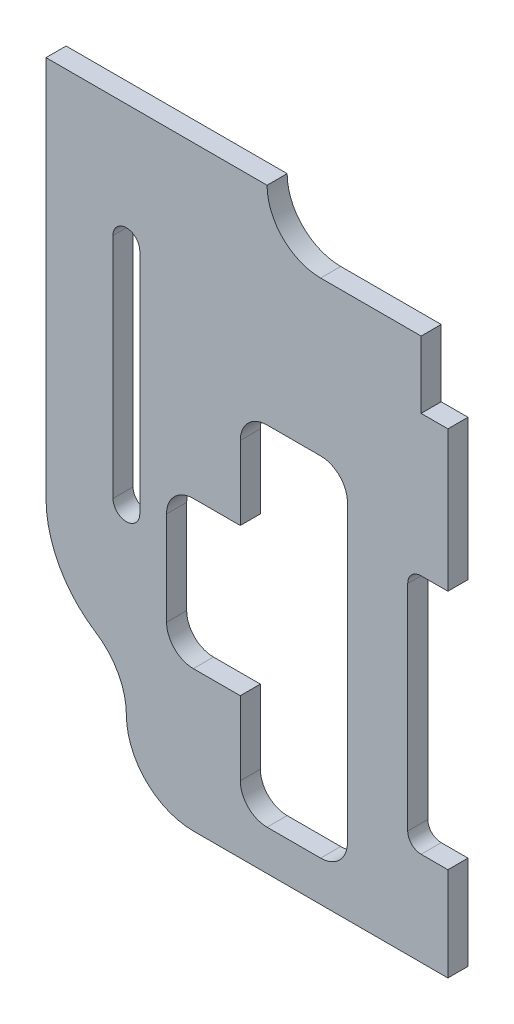
from build123d import *

# Parameters (mm, degrees)
BOSS_EXTRUDE1_DEPTH = 1.5


with BuildPart() as part:
    # Sketch1 → Boss-Extrude1 (new body)
    with BuildSketch(Plane.XY):
        with BuildLine():
            Line((-19, 0), (0, 0))
            Line((0, 0), (0, 7))
            Line((0, 7), (-2, 7))
            ThreePointArc((-2, 7), (-2.707106781, 7.292893219), (-3, 8))
            Line((-3, 8), (-3, 24))
            ThreePointArc((-3, 24), (-2.707106781, 24.707106781), (-2, 25))
            Line((-2, 25), (0, 25))
            Line((0, 25), (0, 35.5))
            Line((0, 35.5), (-2, 35.5))
            Line((-2, 35.5), (-2, 40.5))
            Line((-2, 40.5), (-9.5, 40.5))
            ThreePointArc((-9.5, 40.5), (-12.328427125, 41.671572875), (-13.5, 44.5))
            Line((-13.5, 44.5), (-30, 44.5))
            Line((-30, 44.5), (-30, 16))
            ThreePointArc((-30, 16), (-29.012989214, 12.12927861), (-26.292993631, 9.203821656))
            ThreePointArc((-26.292993631, 9.203821656), (-24.610522135, 7.394260653), (-24, 5))
            ThreePointArc((-24, 5), (-22.535533906, 1.464466094), (-19, 0))
        make_face()
        with BuildLine():
            Line((-25, 35.5), (-25, 18.5))
            ThreePointArc((-25, 18.5), (-24, 17.5), (-23, 18.5))
            Line((-23, 18.5), (-23, 35.5))
            ThreePointArc((-23, 35.5), (-24, 36.5), (-25, 35.5))
        make_face(mode=Mode.SUBTRACT)
        with BuildLine():
            Line((-7.5, 5), (-7.5, 27))
            ThreePointArc((-7.5, 27), (-8.085786438, 28.414213562), (-9.5, 29))
            Line((-9.5, 29), (-13.5, 29))
            ThreePointArc((-13.5, 29), (-14.914213562, 28.414213562), (-15.5, 27))
            Line((-15.5, 27), (-15.5, 21.5))
            Line((-15.5, 21.5), (-19, 21.5))
            ThreePointArc((-19, 21.5), (-20.414213562, 20.914213562), (-21, 19.5))
            Line((-21, 19.5), (-21, 12.5))
            ThreePointArc((-21, 12.5), (-20.414213562, 11.085786438), (-19, 10.5))
            Line((-19, 10.5), (-15.5, 10.5))
            Line((-15.5, 10.5), (-15.5, 5))
            ThreePointArc((-15.5, 5), (-14.914213562, 3.585786438), (-13.5, 3))
            Line((-13.5, 3), (-9.5, 3))
            ThreePointArc((-9.5, 3), (-8.085786438, 3.585786438), (-7.5, 5))
        make_face(mode=Mode.SUBTRACT)
    extrude(amount=BOSS_EXTRUDE1_DEPTH)


solid = part.part
